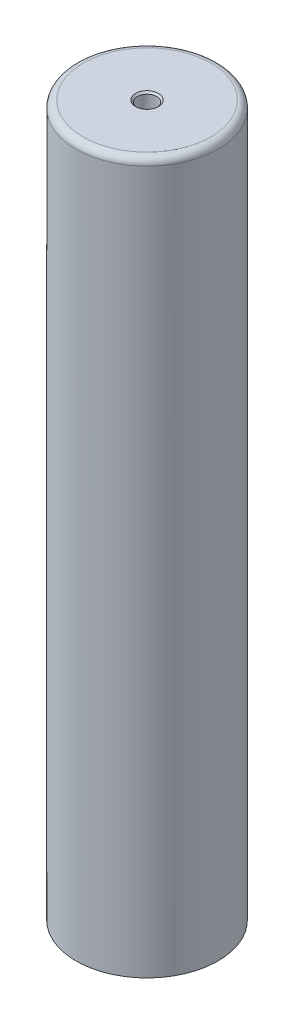
from build123d import *

# Parameters (mm, degrees)
SKETCH1_W                   = 25
SKETCH1_H                   = 250
M8_TAPPED_HOLE1_D           = 6.8
M8_TAPPED_HOLE1_DEPTH       = 16.75
M8_TAPPED_HOLE1_CSINK_D     = 8.05
M8_TAPPED_HOLE1_CSINK_ANGLE = 90
M8_TAPPED_HOLE1_TIP         = 2.042926105
FILLET1_R                   = 2.5


with BuildPart() as part:
    # Sketch1 → Revolve1 (revolve)
    with BuildSketch(Plane.XY, mode=Mode.PRIVATE) as revolve1_sk:
        with Locations((12.5, 125)):
            Rectangle(SKETCH1_W, SKETCH1_H)
    revolve(revolve1_sk.sketch.rotate(Axis((0, 0, 0), (0, 1, 0)), 90), axis=Axis((0, 0, 0), (0, 1, 0)))

    # M8 Tapped Hole1
    with Locations(Plane.ZX.offset(250)):
        with Locations((0, 0)):
            CounterSinkHole(M8_TAPPED_HOLE1_D / 2, M8_TAPPED_HOLE1_CSINK_D / 2, depth=M8_TAPPED_HOLE1_DEPTH, counter_sink_angle=M8_TAPPED_HOLE1_CSINK_ANGLE)
            with Locations((0, 0, -(M8_TAPPED_HOLE1_DEPTH + M8_TAPPED_HOLE1_TIP / 2))):  # 118° drill point
                Cone(0, M8_TAPPED_HOLE1_D / 2, M8_TAPPED_HOLE1_TIP, mode=Mode.SUBTRACT)

    # Fillet1
    fillet1_edges = [part.edges().sort_by_distance(p)[0] for p in [
        (0, 250, 25),
    ]]
    fillet(fillet1_edges, radius=FILLET1_R)


solid = part.part
